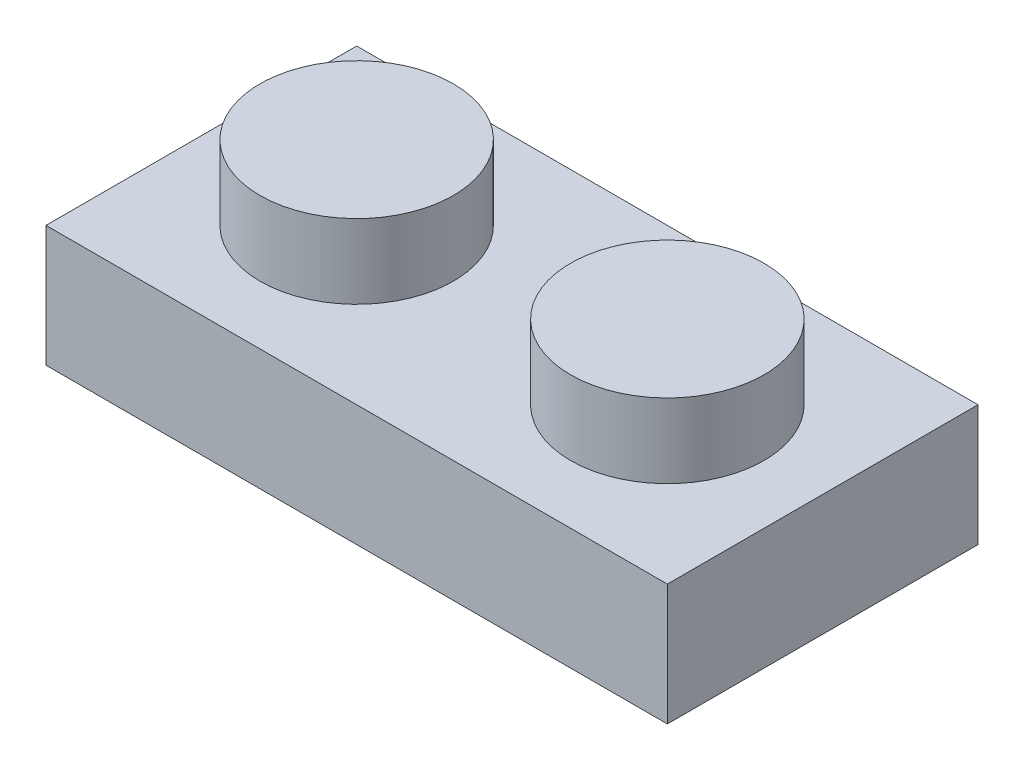
from build123d import *

# Parameters (mm, degrees)
SKETCH1_W           = 15.9
SKETCH1_H           = 7.95
BOSS_EXTRUDE1_DEPTH = 3.1
SKETCH2_R           = 2.475
BOSS_EXTRUDE2_DEPTH = 1.9
SKETCH3_W           = 12.9
SKETCH3_H           = 4.95
CUT_EXTRUDE1_DEPTH  = 2


with BuildPart() as part:
    # Sketch1 → Boss-Extrude1 (new body)
    with BuildSketch(Plane(origin=(0, 0, 0), x_dir=(1, 0, 0), z_dir=(0, 1, 0))):
        with Locations((-41.303484122, -10.097424035)):
            Rectangle(SKETCH1_W, SKETCH1_H)
    extrude(amount=BOSS_EXTRUDE1_DEPTH)

    # Sketch2 → Boss-Extrude2 (add)
    with BuildSketch(Plane(origin=(0, 3.1, 0), x_dir=(1, 0, 0), z_dir=(0, 1, 0))):
        with Locations(Location((-45.278484122, -10.097424035, 0), (0, 0, 90))):
            Circle(SKETCH2_R)
        with Locations(Location((-37.328484122, -10.097424035, 0), (0, 0, 90))):
            Circle(SKETCH2_R)
    extrude(amount=BOSS_EXTRUDE2_DEPTH)

    # Sketch3 → Cut-Extrude1 (cut)
    with BuildSketch(Plane.XZ):
        with Locations((-41.303484122, 10.097424035)):
            Rectangle(SKETCH3_W, SKETCH3_H)
    extrude(amount=-CUT_EXTRUDE1_DEPTH, mode=Mode.SUBTRACT)


solid = part.part
